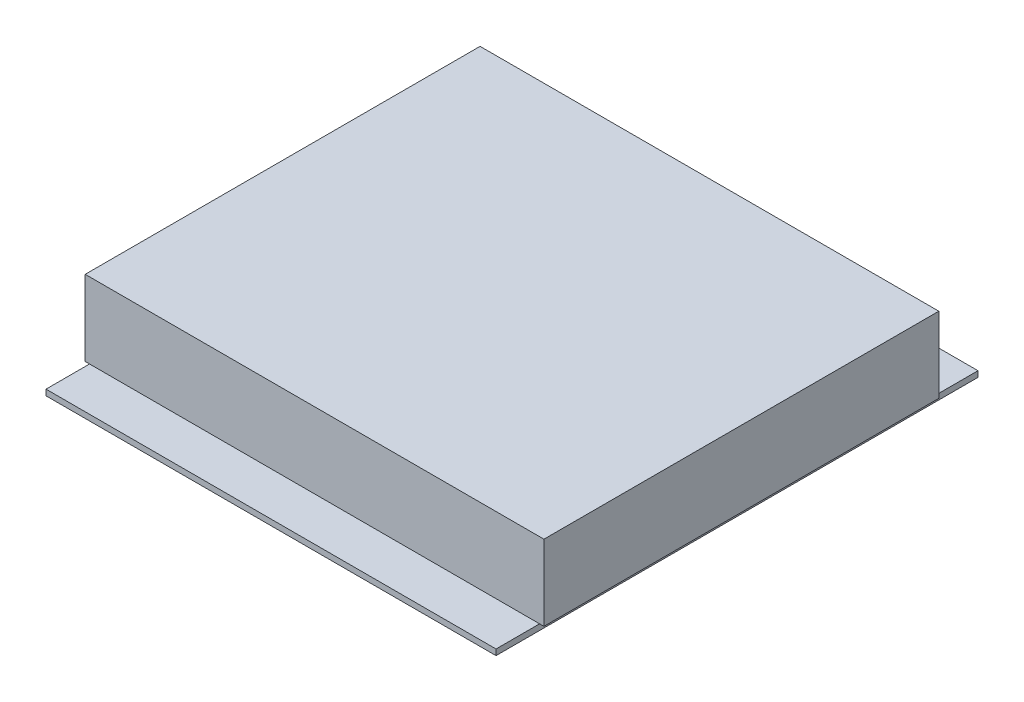
from build123d import *

# Parameters (mm, degrees)
SKETCH_1_W      = 158
SKETCH_1_H      = 136
EXTRUDE_1_DEPTH = 26
SKETCH_2_W      = 155
SKETCH_2_H      = 166
EXTRUDE_2_DEPTH = 2


with BuildPart() as part:
    # 草图1 → 拉伸1 (new body)
    with BuildSketch(Plane(origin=(0, 0, 0), x_dir=(1, 0, 0), z_dir=(0, 1, 0))):
        Rectangle(SKETCH_1_W, SKETCH_1_H)
    extrude(amount=EXTRUDE_1_DEPTH)

    # 草图2 → 拉伸2 (add)
    with BuildSketch(Plane.XZ):
        Rectangle(SKETCH_2_W, SKETCH_2_H)
    extrude(amount=EXTRUDE_2_DEPTH)


solid = part.part
